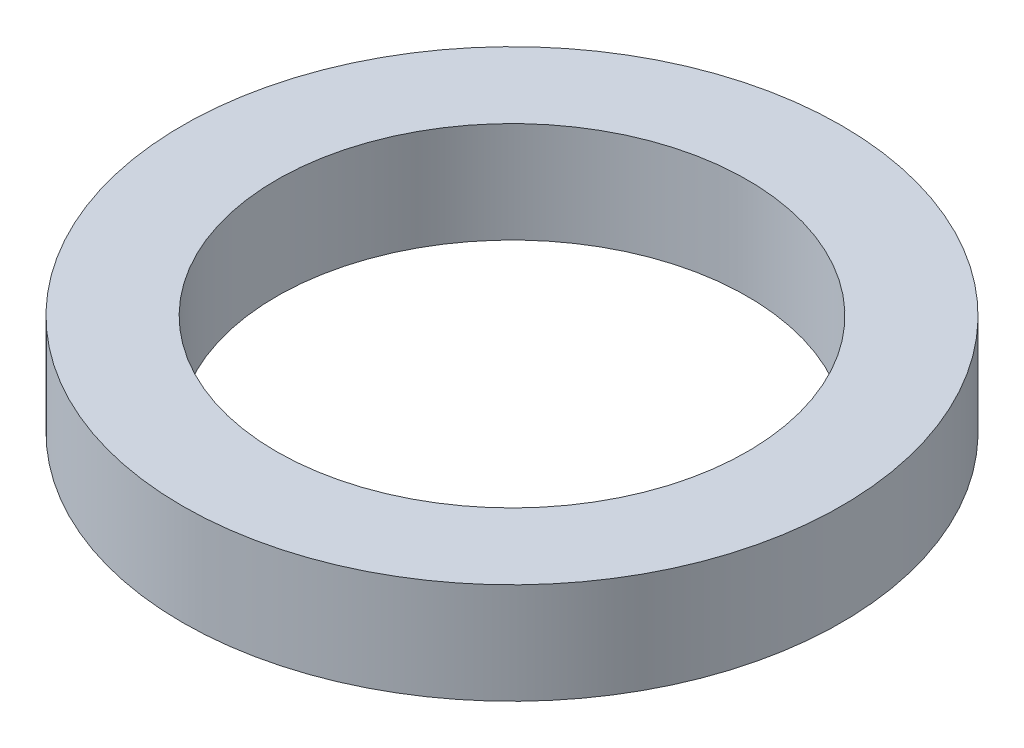
from build123d import *

# Parameters (mm, degrees)
SKETCH1_R           = 4.9
SKETCH1_R_2         = 3.5
BOSS_EXTRUDE1_DEPTH = 1.5


with BuildPart() as part:
    # Sketch1 → Boss-Extrude1 (new body)
    with BuildSketch(Plane(origin=(0, 0, 0), x_dir=(1, 0, 0), z_dir=(0, 1, 0))):
        with Locations(Location((0, 0, 0), (0, 0, 270))):
            Circle(SKETCH1_R)
        with Locations(Location((0, 0, 0), (0, 0, 270))):
            Circle(SKETCH1_R_2, mode=Mode.SUBTRACT)
    extrude(amount=BOSS_EXTRUDE1_DEPTH)


solid = part.part
